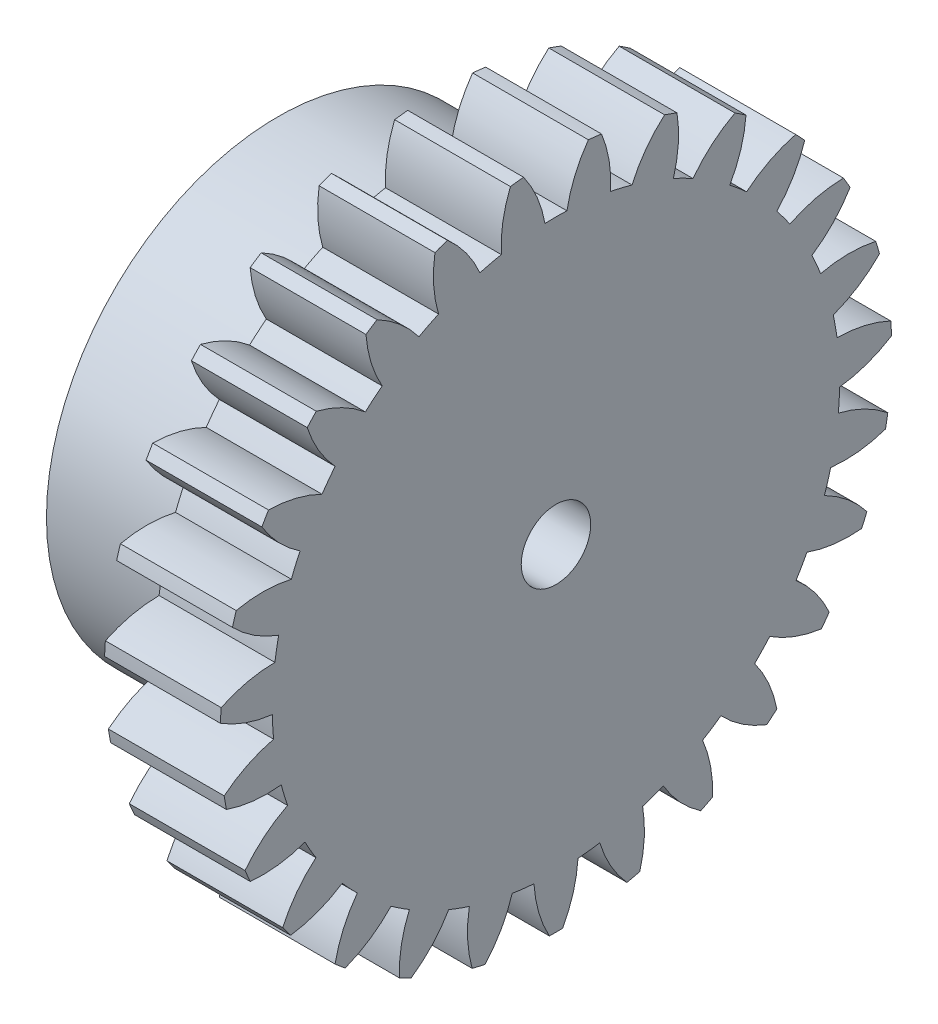
from build123d import *

# Parameters (mm, degrees)
BASPROSKE_W         = 5
BASPROSKE_H         = 14.5
TOOTHCUT_DEPTH      = 22.106870919
TEETHCUTS_COUNT     = 27
TEETHCUTS_ANGLE     = 346.666666667
BORSKE_R            = 1.5
BORE_DEPTH          = 50.0000508
SKETCH2_R           = 10
BOSS_EXTRUDE1_DEPTH = 7
CUT_EXTRUDE3_START  = -7
SKETCH3_R           = 1.5
CUT_EXTRUDE3_DEPTH  = 7


with BuildPart() as part:
    # BasProSke → Base-Revolve (revolve)
    with BuildSketch(Plane(origin=(0, 0, 0), x_dir=(1, 0, 0), z_dir=(0, 1, 0)), mode=Mode.PRIVATE) as base_revolve_sk:
        with Locations((2.5, 7.25)):
            Rectangle(BASPROSKE_W, BASPROSKE_H)
    revolve(base_revolve_sk.sketch.rotate(Axis((-10, 0, 0), (1, 0, 0)), 180), axis=Axis((-10, 0, 0), (1, 0, 0)))

    # TooCutSke → ToothCut (cut, through all)
    with BuildSketch(Plane(origin=(0, 0, 0), x_dir=(0, 0, -1), z_dir=(1, 0, 0))):
        with BuildLine():
            ThreePointArc((0.474054864, 12.239823242), (0, 12.249), (-0.474054864, 12.239823242))
            ThreePointArc((-0.474054864, 12.239823242), (-0.820231692, 13.40120918), (-1.416685779, 14.456149092))
            ThreePointArc((-1.416685779, 14.456149092), (0, 14.5254), (1.416685779, 14.456149092))
            ThreePointArc((1.416685779, 14.456149092), (0.820231692, 13.40120918), (0.474054864, 12.239823242))
        make_face()
    toothcut = extrude(amount=TOOTHCUT_DEPTH, mode=Mode.SUBTRACT)

    # TeethCuts: ToothCut ×27 about axis
    teethcuts_axis = Axis((-10, 0, 0), (1, 0, 0))
    for i in range(1, TEETHCUTS_COUNT):
        add(toothcut.rotate(teethcuts_axis, i * TEETHCUTS_ANGLE / (TEETHCUTS_COUNT - 1)), mode=Mode.SUBTRACT)

    # BorSke → Bore (cut, symmetric)
    with BuildSketch(Plane(origin=(0, 0, 0), x_dir=(0, 0, -1), z_dir=(1, 0, 0))):
        with Locations(Location((0, 0, 0), (0, 0, 180))):
            Circle(BORSKE_R)
    extrude(amount=BORE_DEPTH, both=True, mode=Mode.SUBTRACT)

    # Sketch2 → Boss-Extrude1 (add)
    with BuildSketch(Plane.ZY):
        with Locations(Location((0, 0, 0), (0, 0, 180))):
            Circle(SKETCH2_R)
    extrude(amount=BOSS_EXTRUDE1_DEPTH)

    # Sketch3 → Cut-Extrude3 (cut)
    with BuildSketch(Plane.ZY.offset(7).offset(CUT_EXTRUDE3_START)):
        Circle(SKETCH3_R)
        with Locations((5, 0)):
            Circle(SKETCH3_R)
        with Locations((-5, 0)):
            Circle(SKETCH3_R)
    extrude(amount=CUT_EXTRUDE3_DEPTH, mode=Mode.SUBTRACT)


solid = part.part
